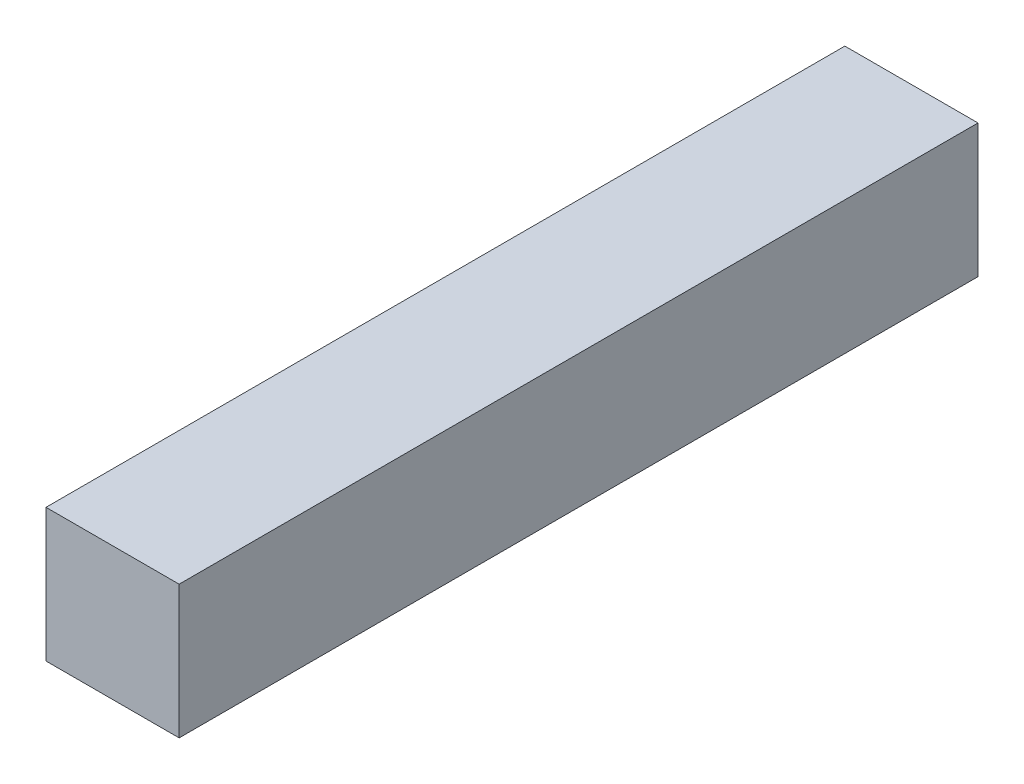
from build123d import *

# Parameters (mm, degrees)
SKETCH1_W           = 25.4
SKETCH1_H           = 25.4
BOSS_EXTRUDE1_DEPTH = 152.4


with BuildPart() as part:
    # Sketch1 → Boss-Extrude1 (new body)
    with BuildSketch(Plane.XY):
        Rectangle(SKETCH1_W, SKETCH1_H)
    extrude(amount=BOSS_EXTRUDE1_DEPTH)


solid = part.part
